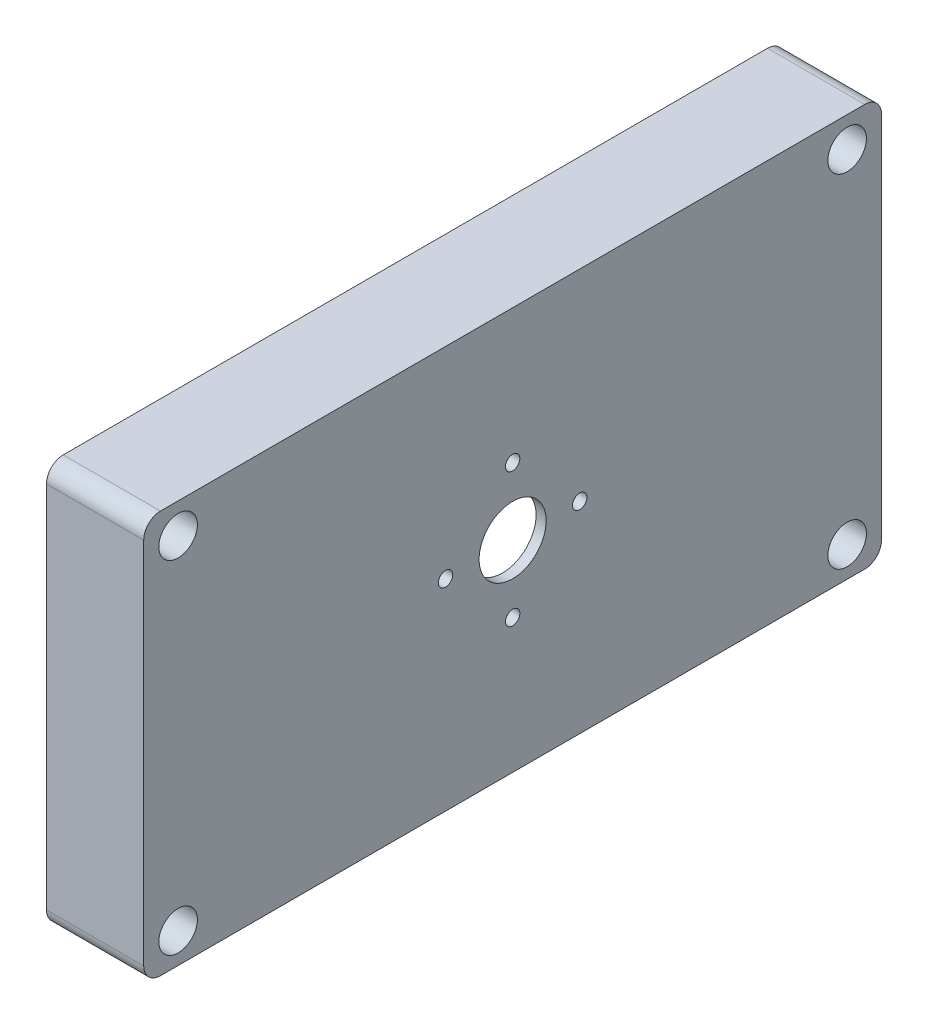
from build123d import *

# Parameters (mm, degrees)
SKETCH1_W                                   = 220
SKETCH1_H                                   = 120
BOSS_EXTRUDE1_DEPTH                         = 14.5
CUT_EXTRUDE1_DEPTH                          = 26
FILLET1_R                                   = 1
FILLET2_R                                   = 10
CUT_EXTRUDE3_DEPTH                          = 3
CBORE_FOR_M4_CHEESE_HEAD_SCREW1_D           = 4.8
CBORE_FOR_M4_CHEESE_HEAD_SCREW1_CBORE_D     = 11.5
CBORE_FOR_M4_CHEESE_HEAD_SCREW1_CBORE_DEPTH = 20
FILLET3_R                                   = 5
SKETCH8_R                                   = 4.5
CUT_EXTRUDE4_DEPTH                          = 10
CUT_EXTRUDE5_REACH                          = 130.612
SKETCH9_R                                   = 10
M4_CLEARANCE_HOLE1_D                        = 4.3
CIRPATTERN1_COUNT                           = 4


with BuildPart() as part:
    # Sketch1 → Boss-Extrude1 (new, symmetric)
    with BuildSketch(Plane(origin=(0, 0, 0), x_dir=(0, 0, -1), z_dir=(1, 0, 0))):
        Rectangle(SKETCH1_W, SKETCH1_H)
    extrude(amount=BOSS_EXTRUDE1_DEPTH, both=True)

    # Sketch2 → Cut-Extrude1 (cut)
    with BuildSketch(Plane.ZY.offset(14.5)):
        Polygon((-87.25, 53.4), (87.25, 53.4), (87.25, 35.9), (103.4, 18.75), (103.4, -18.75), (87.25, -35.9), (87.25, -53.4), (-87.25, -53.4), (-87.25, -35.9), (-103.4, -18.75), (-103.4, 18.75), (-87.25, 35.9), align=None)
    extrude(amount=-CUT_EXTRUDE1_DEPTH, mode=Mode.SUBTRACT)

    # Fillet1
    fillet1_edges = [part.edges().sort_by_distance(p)[0] for p in [
        (-1.5, -18.75, 103.4),
        (-1.5, -53.4, 87.25),
        (-1.5, -53.4, -87.25),
        (-1.5, -18.75, -103.4),
        (-1.5, 18.75, -103.4),
        (-1.5, 53.4, -87.25),
        (-1.5, 53.4, 87.25),
        (-1.5, 18.75, 103.4),
    ]]
    fillet(fillet1_edges, radius=FILLET1_R)

    # Fillet2
    fillet2_edges = [part.edges().sort_by_distance(p)[0] for p in [
        (-1.5, -35.9, 87.25),
        (-1.5, -35.9, -87.25),
        (-1.5, 35.9, -87.25),
        (-1.5, 35.9, 87.25),
    ]]
    fillet(fillet2_edges, radius=FILLET2_R)

    # Sketch3 → Cut-Extrude3 (cut)
    with BuildSketch(Plane.ZY.offset(14.5)):
        with BuildLine():
            Line((92.05, 39.867350241), (92.05, 52.4))
            ThreePointArc((92.05, 52.4), (90.351219331, 56.501219331), (86.25, 58.2))
            Line((86.25, 58.2), (-86.25, 58.2))
            ThreePointArc((-86.25, 58.2), (-90.351219331, 56.501219331), (-92.05, 52.4))
            Line((-92.05, 52.4), (-92.05, 39.867350241))
            ThreePointArc((-92.05, 39.867350241), (-92.416498559, 37.949730931), (-93.464332239, 36.302421125))
            Line((-93.464332239, 36.302421125), (-106.62247558, 22.329532067))
            ThreePointArc((-106.62247558, 22.329532067), (-107.791213146, 20.492148053), (-108.2, 18.353264976))
            Line((-108.2, 18.353264976), (-108.2, -18.353264976))
            ThreePointArc((-108.2, -18.353264976), (-107.791213146, -20.492148053), (-106.62247558, -22.329532067))
            Line((-106.62247558, -22.329532067), (-93.464332239, -36.302421125))
            ThreePointArc((-93.464332239, -36.302421125), (-92.416498559, -37.949730931), (-92.05, -39.867350241))
            Line((-92.05, -39.867350241), (-92.05, -52.4))
            ThreePointArc((-92.05, -52.4), (-90.351219331, -56.501219331), (-86.25, -58.2))
            Line((-86.25, -58.2), (86.25, -58.2))
            ThreePointArc((86.25, -58.2), (90.351219331, -56.501219331), (92.05, -52.4))
            Line((92.05, -52.4), (92.05, -39.867350241))
            ThreePointArc((92.05, -39.867350241), (92.416498559, -37.949730931), (93.464332239, -36.302421125))
            Line((93.464332239, -36.302421125), (106.62247558, -22.329532067))
            ThreePointArc((106.62247558, -22.329532067), (107.791213146, -20.492148053), (108.2, -18.353264976))
            Line((108.2, -18.353264976), (108.2, 18.353264976))
            ThreePointArc((108.2, 18.353264976), (107.791213146, 20.492148053), (106.62247558, 22.329532067))
            Line((106.62247558, 22.329532067), (93.464332239, 36.302421125))
            ThreePointArc((93.464332239, 36.302421125), (92.416498559, 37.949730931), (92.05, 39.867350241))
        make_face()
        with BuildLine():
            ThreePointArc((-86.25, 55.4), (-88.371320344, 54.521320344), (-89.25, 52.4))
            Line((-89.25, 52.4), (-89.25, 39.867350241))
            ThreePointArc((-89.25, 39.867350241), (-89.813843937, 36.917166686), (-91.425895752, 34.382843909))
            Line((-91.425895752, 34.382843909), (-104.584039093, 20.409954851))
            ThreePointArc((-104.584039093, 20.409954851), (-105.188558524, 19.459583809), (-105.4, 18.353264976))
            Line((-105.4, 18.353264976), (-105.4, -18.353264976))
            ThreePointArc((-105.4, -18.353264976), (-105.188558524, -19.459583809), (-104.584039093, -20.409954851))
            Line((-104.584039093, -20.409954851), (-91.425895752, -34.382843909))
            ThreePointArc((-91.425895752, -34.382843909), (-89.813843937, -36.917166686), (-89.25, -39.867350241))
            Line((-89.25, -39.867350241), (-89.25, -52.4))
            ThreePointArc((-89.25, -52.4), (-88.371320344, -54.521320344), (-86.25, -55.4))
            Line((-86.25, -55.4), (86.25, -55.4))
            ThreePointArc((86.25, -55.4), (88.371320344, -54.521320344), (89.25, -52.4))
            Line((89.25, -52.4), (89.25, -39.867350241))
            ThreePointArc((89.25, -39.867350241), (89.813843937, -36.917166686), (91.425895752, -34.382843909))
            Line((91.425895752, -34.382843909), (104.584039093, -20.409954851))
            ThreePointArc((104.584039093, -20.409954851), (105.188558524, -19.459583809), (105.4, -18.353264976))
            Line((105.4, -18.353264976), (105.4, 18.353264976))
            ThreePointArc((105.4, 18.353264976), (105.188558524, 19.459583809), (104.584039093, 20.409954851))
            Line((104.584039093, 20.409954851), (91.425895752, 34.382843909))
            ThreePointArc((91.425895752, 34.382843909), (89.813843937, 36.917166686), (89.25, 39.867350241))
            Line((89.25, 39.867350241), (89.25, 52.4))
            ThreePointArc((89.25, 52.4), (88.371320344, 54.521320344), (86.25, 55.4))
            Line((86.25, 55.4), (-86.25, 55.4))
        make_face(mode=Mode.SUBTRACT)
    extrude(amount=-CUT_EXTRUDE3_DEPTH, mode=Mode.SUBTRACT)

    # CBORE for M4 Cheese Head Screw1 (through all)
    with Locations(Plane(origin=(14.5, 0, 0), x_dir=(0, 0, -1), z_dir=(1, 0, 0))):
        with Locations((99.75, 51), (-99.75, 51), (-99.75, -51), (99.75, -51)):
            CounterBoreHole(CBORE_FOR_M4_CHEESE_HEAD_SCREW1_D / 2, CBORE_FOR_M4_CHEESE_HEAD_SCREW1_CBORE_D / 2, CBORE_FOR_M4_CHEESE_HEAD_SCREW1_CBORE_DEPTH)

    # Fillet3
    fillet3_edges = [part.edges().sort_by_distance(p)[0] for p in [
        (0, 60, 110),
        (0, 60, -110),
        (0, -60, -110),
        (0, -60, 110),
    ]]
    fillet(fillet3_edges, radius=FILLET3_R)

    # Sketch8 → Cut-Extrude4 (cut)
    with BuildSketch(Plane.ZY.offset(14.5)):
        with Locations((99.75, 38.25)):
            Circle(SKETCH8_R)
        with Locations((99.75, -38.25)):
            Circle(SKETCH8_R)
        with Locations((-99.75, -38.25)):
            Circle(SKETCH8_R)
        with Locations((-99.75, 38.25)):
            Circle(SKETCH8_R)
    extrude(amount=-CUT_EXTRUDE4_DEPTH, mode=Mode.SUBTRACT)

    # Sketch9 → Cut-Extrude5 (cut, up to next)
    with BuildSketch(Plane(origin=(14.5, 0, 0), x_dir=(0, 0, -1), z_dir=(1, 0, 0)), mode=Mode.PRIVATE) as cut_extrude5_sk1:
        Circle(SKETCH9_R)
    cut_extrude5_tool1 = extrude(cut_extrude5_sk1.sketch, amount=-CUT_EXTRUDE5_REACH, mode=Mode.PRIVATE) & part.part
    add(cut_extrude5_tool1.solids().sort_by_distance((14.5, 0, 0))[0], mode=Mode.SUBTRACT)

    # M4 Clearance Hole1 (through all)
    with Locations(Plane(origin=(14.5, 0, 0), x_dir=(0, 0, -1), z_dir=(1, 0, 0))):
        with Locations((0, 20)):
            m4_clearance_hole1 = Hole(M4_CLEARANCE_HOLE1_D / 2)

    # CirPattern1: M4 Clearance Hole1 ×4 about axis
    cirpattern1_axis = Axis((0, 0, 0), (1, 0, 0))
    for i in range(1, CIRPATTERN1_COUNT):
        add(m4_clearance_hole1.rotate(cirpattern1_axis, i * 360 / CIRPATTERN1_COUNT), mode=Mode.SUBTRACT)


solid = part.part
